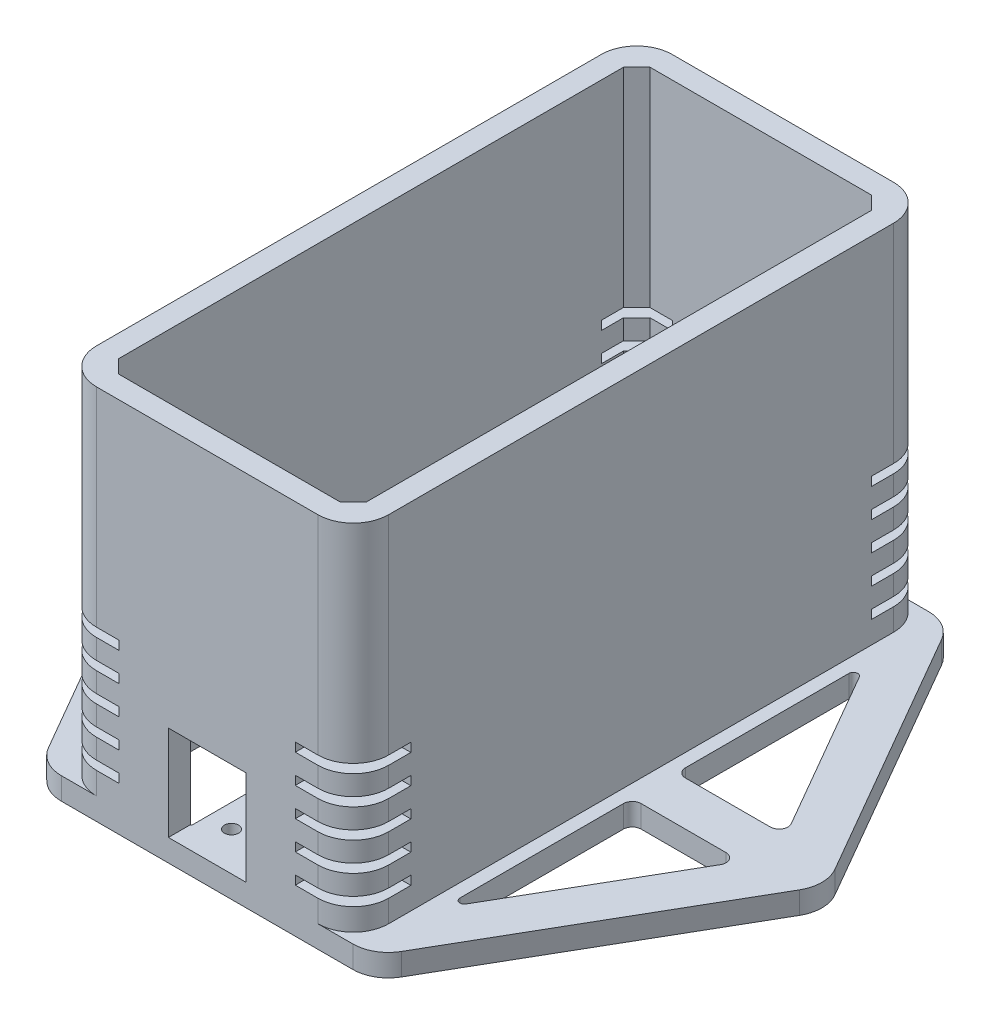
from build123d import *

# Parameters (mm, degrees)
BOSS_EXTRUDE1_DEPTH            = 5
FILLET1_R                      = 8
BOSS_EXTRUDE2_DEPTH            = 80
CUT_EXTRUDE1_DEPTH             = 85
CUT_EXTRUDE2_DEPTH             = 5
SKETCH9_W                      = 14
SKETCH9_H                      = 13
CUT_EXTRUDE3_DEPTH             = 2
LPATTERN1_COUNT                = 5
LPATTERN1_PITCH                = 6.5
MIRROR1_COPY_1_SKETCH_W        = 14
MIRROR1_COPY_1_SKETCH_H        = 13
MIRROR1_COPY_1_DEPTH           = 2
MIRROR1_COPY_2_SKETCH_W        = 14
MIRROR1_COPY_2_SKETCH_H        = 13
MIRROR1_COPY_2_DEPTH           = 2
MIRROR1_COPY_3_SKETCH_W        = 14
MIRROR1_COPY_3_SKETCH_H        = 13
MIRROR1_COPY_3_DEPTH           = 2
MIRROR1_COPY_4_SKETCH_W        = 14
MIRROR1_COPY_4_SKETCH_H        = 13
MIRROR1_COPY_4_DEPTH           = 2
SKETCH10_W                     = 17
SKETCH10_H                     = 5
BOSS_EXTRUDE3_DEPTH            = 15
SKETCH11_R                     = 1.6
CUT_EXTRUDE4_DEPTH             = 5
CUT_EXTRUDE5_REACH             = 170.223
SKETCH12_W                     = 17.5
SKETCH12_H                     = 21.4
CUT_EXTRUDE5_DIRECTION_2_REACH = 170.223
SKETCH14_W                     = 17
SKETCH14_H                     = 5
BOSS_EXTRUDE4_DEPTH            = 15
SKETCH16_R                     = 1.6
CUT_EXTRUDE6_DEPTH             = 5
MIRROR2_COPY_1_SKETCH_W        = 14
MIRROR2_COPY_1_SKETCH_H        = 13
MIRROR2_COPY_1_DEPTH           = 2
MIRROR2_COPY_2_SKETCH_W        = 14
MIRROR2_COPY_2_SKETCH_H        = 13
MIRROR2_COPY_2_DEPTH           = 2
MIRROR2_COPY_3_SKETCH_W        = 14
MIRROR2_COPY_3_SKETCH_H        = 13
MIRROR2_COPY_3_DEPTH           = 2
MIRROR2_COPY_4_SKETCH_W        = 14
MIRROR2_COPY_4_SKETCH_H        = 13
MIRROR2_COPY_4_DEPTH           = 2
MIRROR2_COPY_5_SKETCH_W        = 14
MIRROR2_COPY_5_SKETCH_H        = 13
MIRROR2_COPY_5_DEPTH           = 2
MIRROR2_COPY_6_SKETCH_W        = 14
MIRROR2_COPY_6_SKETCH_H        = 13
MIRROR2_COPY_6_DEPTH           = 2
MIRROR2_COPY_7_SKETCH_W        = 14
MIRROR2_COPY_7_SKETCH_H        = 13
MIRROR2_COPY_7_DEPTH           = 2
MIRROR2_COPY_8_SKETCH_W        = 14
MIRROR2_COPY_8_SKETCH_H        = 13
MIRROR2_COPY_8_DEPTH           = 2
MIRROR2_COPY_9_SKETCH_W        = 14
MIRROR2_COPY_9_SKETCH_H        = 13
MIRROR2_COPY_9_DEPTH           = 2


with BuildPart() as part:
    # Sketch1 → Boss-Extrude1 (new body)
    with BuildSketch(Plane(origin=(0, 0, 0), x_dir=(1, 0, 0), z_dir=(0, 1, 0))):
        Polygon((-75.055534995, 0), (-37.527767497, -65), (37.527767497, -65), (75.055534995, 0), (37.527767497, 65), (-37.527767497, 65), align=None)
    extrude(amount=BOSS_EXTRUDE1_DEPTH)

    # Fillet1
    fillet1_edges = [part.edges().sort_by_distance(p)[0] for p in [
        (-37.527767497, 2.5, -65),
        (37.527767497, 2.5, -65),
        (75.055534995, 2.5, 0),
        (37.527767497, 2.5, 65),
        (-37.527767497, 2.5, 65),
        (-75.055534995, 2.5, 0),
    ]]
    fillet(fillet1_edges, radius=FILLET1_R)

    # Sketch3 → Boss-Extrude2 (add)
    with BuildSketch(Plane(origin=(0, 5, 0), x_dir=(1, 0, 0), z_dir=(0, 1, 0))):
        with BuildLine():
            Line((-25, 65), (25, 65))
            ThreePointArc((25, 65), (30.656854249, 62.656854249), (33, 57))
            Line((33, 57), (33, -57))
            ThreePointArc((33, -57), (30.656854249, -62.656854249), (25, -65))
            Line((25, -65), (-25, -65))
            ThreePointArc((-25, -65), (-30.656854249, -62.656854249), (-33, -57))
            Line((-33, -57), (-33, 57))
            ThreePointArc((-33, 57), (-30.656854249, 62.656854249), (-25, 65))
        make_face()
    extrude(amount=BOSS_EXTRUDE2_DEPTH)

    # Sketch4 → Cut-Extrude1 (cut)
    with BuildSketch(Plane(origin=(0, 85, 0), x_dir=(1, 0, 0), z_dir=(0, 1, 0))):
        Polygon((-28, 57), (-25, 60), (25, 60), (28, 57), (28, -57), (25, -60), (-25, -60), (-28, -57), align=None)
    extrude(amount=-CUT_EXTRUDE1_DEPTH, mode=Mode.SUBTRACT)

    # Sketch8 → Cut-Extrude2 (cut)
    with BuildSketch(Plane(origin=(0, 0, 0), x_dir=(1, 0, 0), z_dir=(0, 1, 0))):
        with BuildLine():
            Line((-37.866025404, 44.41412012), (-58.889727457, 8))
            ThreePointArc((-58.889727457, 8), (-58.889727457, 6), (-57.15767665, 5))
            Line((-57.15767665, 5), (-38, 5))
            ThreePointArc((-38, 5), (-36.585786438, 5.585786438), (-36, 7))
            Line((-36, 7), (-36, 43.91412012))
            ThreePointArc((-36, 43.91412012), (-36.741180955, 44.880045946), (-37.866025404, 44.41412012))
        make_face()
        with BuildLine():
            Line((-36, -7), (-36, -43.91412012))
            ThreePointArc((-36, -43.91412012), (-36.741180955, -44.880045946), (-37.866025404, -44.41412012))
            Line((-37.866025404, -44.41412012), (-58.889727457, -8))
            ThreePointArc((-58.889727457, -8), (-58.889727457, -6), (-57.15767665, -5))
            Line((-57.15767665, -5), (-38, -5))
            ThreePointArc((-38, -5), (-36.585786438, -5.585786438), (-36, -7))
        make_face()
        with BuildLine():
            Line((37.866025404, -44.41412012), (58.889727457, -8))
            ThreePointArc((58.889727457, -8), (58.889727457, -6), (57.15767665, -5))
            Line((57.15767665, -5), (38, -5))
            ThreePointArc((38, -5), (36.585786438, -5.585786438), (36, -7))
            Line((36, -7), (36, -43.91412012))
            ThreePointArc((36, -43.91412012), (36.741180955, -44.880045946), (37.866025404, -44.41412012))
        make_face()
        with BuildLine():
            Line((36, 7), (36, 43.91412012))
            ThreePointArc((36, 43.91412012), (36.741180955, 44.880045946), (37.866025404, 44.41412012))
            Line((37.866025404, 44.41412012), (58.889727457, 8))
            ThreePointArc((58.889727457, 8), (58.889727457, 6), (57.15767665, 5))
            Line((57.15767665, 5), (38, 5))
            ThreePointArc((38, 5), (36.585786438, 5.585786438), (36, 7))
        make_face()
    extrude(amount=CUT_EXTRUDE2_DEPTH, mode=Mode.SUBTRACT)

    # Sketch9 → Cut-Extrude3 (cut)
    with BuildSketch(Plane(origin=(0, 10, 0), x_dir=(1, 0, 0), z_dir=(0, 1, 0))):
        with Locations((-26.908965344, -58.5)):
            Rectangle(SKETCH9_W, SKETCH9_H)
    cut_extrude3 = extrude(amount=CUT_EXTRUDE3_DEPTH, mode=Mode.SUBTRACT)

    # LPattern1: Cut-Extrude3 ×5
    with Locations(*[(0, i * LPATTERN1_PITCH, 0) for i in range(1, LPATTERN1_COUNT)]):
        add(cut_extrude3, mode=Mode.SUBTRACT)

    # Mirror1: Cut-Extrude3 across plane
    add(cut_extrude3.mirror(Plane(origin=(0, 0, 0), x_dir=(0, 0, 1), z_dir=(1, 0, 0))), mode=Mode.SUBTRACT)

    # Mirror1 copy 1 sketch → Mirror1 copy 1 (cut)
    with BuildSketch(Plane(origin=(0, 16.5, 0), x_dir=(-1, 0, 0), z_dir=(0, 1, 0))):
        with Locations((-26.908965344, 58.5)):
            Rectangle(MIRROR1_COPY_1_SKETCH_W, MIRROR1_COPY_1_SKETCH_H)
    extrude(amount=MIRROR1_COPY_1_DEPTH, mode=Mode.SUBTRACT)

    # Mirror1 copy 2 sketch → Mirror1 copy 2 (cut)
    with BuildSketch(Plane(origin=(0, 23, 0), x_dir=(-1, 0, 0), z_dir=(0, 1, 0))):
        with Locations((-26.908965344, 58.5)):
            Rectangle(MIRROR1_COPY_2_SKETCH_W, MIRROR1_COPY_2_SKETCH_H)
    extrude(amount=MIRROR1_COPY_2_DEPTH, mode=Mode.SUBTRACT)

    # Mirror1 copy 3 sketch → Mirror1 copy 3 (cut)
    with BuildSketch(Plane(origin=(0, 29.5, 0), x_dir=(-1, 0, 0), z_dir=(0, 1, 0))):
        with Locations((-26.908965344, 58.5)):
            Rectangle(MIRROR1_COPY_3_SKETCH_W, MIRROR1_COPY_3_SKETCH_H)
    extrude(amount=MIRROR1_COPY_3_DEPTH, mode=Mode.SUBTRACT)

    # Mirror1 copy 4 sketch → Mirror1 copy 4 (cut)
    with BuildSketch(Plane(origin=(0, 36, 0), x_dir=(-1, 0, 0), z_dir=(0, 1, 0))):
        with Locations((-26.908965344, 58.5)):
            Rectangle(MIRROR1_COPY_4_SKETCH_W, MIRROR1_COPY_4_SKETCH_H)
    extrude(amount=MIRROR1_COPY_4_DEPTH, mode=Mode.SUBTRACT)

    # Sketch10 → Boss-Extrude3 (add)
    with BuildSketch(Plane.XY.offset(-60)):
        with Locations((0, 2.5)):
            Rectangle(SKETCH10_W, SKETCH10_H)
    extrude(amount=BOSS_EXTRUDE3_DEPTH)

    # Sketch11 → Cut-Extrude4 (cut)
    with BuildSketch(Plane.XZ):
        with Locations(Location((3.25, -56.25, 0), (0, 0, 270))):
            Circle(SKETCH11_R)
        with Locations(Location((-3.25, -56.25, 0), (0, 0, 90))):
            Circle(SKETCH11_R)
        with Locations(Location((-3.25, -48.75, 0), (0, 0, 270))):
            Circle(SKETCH11_R)
        with Locations(Location((3.25, -48.75, 0), (0, 0, 90))):
            Circle(SKETCH11_R)
    extrude(amount=-CUT_EXTRUDE4_DEPTH, mode=Mode.SUBTRACT)

    # Cut-Extrude5: up to this face of the body (flat: up to its plane)
    cut_extrude5_end = Plane(part.part.faces().sort_by_distance((0, 41.769226006, -65))[0])
    # Sketch12 → Cut-Extrude5 (cut, up to the picked face)
    with BuildSketch(Plane.XY.offset(-60), mode=Mode.PRIVATE) as cut_extrude5_sk1:
        with Locations((0, 15.7)):
            Rectangle(SKETCH12_W, SKETCH12_H)
    cut_extrude5_tool1 = split(extrude(cut_extrude5_sk1.sketch, amount=-CUT_EXTRUDE5_REACH, mode=Mode.PRIVATE), bisect_by=cut_extrude5_end, keep=Keep.BOTH, mode=Mode.PRIVATE)
    add(cut_extrude5_tool1.solids().sort_by(Axis((0, 15.7, -60), (0, 0, -1)))[0], mode=Mode.SUBTRACT)

    # Cut-Extrude5 direction 2: up to this face of the body (flat: up to its plane)
    cut_extrude5_direction_2_end = Plane(part.part.faces().sort_by_distance((0, 42.197226903, 65))[0])
    # Sketch12 → Cut-Extrude5 direction 2 (cut, up to the picked face)
    with BuildSketch(Plane.XY.offset(-60), mode=Mode.PRIVATE) as cut_extrude5_direction_2_sk1:
        with Locations((0, 15.7)):
            Rectangle(SKETCH12_W, SKETCH12_H)
    cut_extrude5_direction_2_tool1 = split(extrude(cut_extrude5_direction_2_sk1.sketch, amount=CUT_EXTRUDE5_DIRECTION_2_REACH, mode=Mode.PRIVATE), bisect_by=cut_extrude5_direction_2_end, keep=Keep.BOTH, mode=Mode.PRIVATE)
    add(cut_extrude5_direction_2_tool1.solids().sort_by(Axis((0, 15.7, -60), (0, 0, 1)))[0], mode=Mode.SUBTRACT)

    # Sketch14 → Boss-Extrude4 (add)
    with BuildSketch(Plane(origin=(0, 0, 60), x_dir=(-1, 0, 0), z_dir=(0, 0, -1))):
        with Locations((0, 2.5)):
            Rectangle(SKETCH14_W, SKETCH14_H)
    extrude(amount=BOSS_EXTRUDE4_DEPTH)

    # Sketch16 → Cut-Extrude6 (cut)
    with BuildSketch(Plane.XZ):
        with Locations(Location((3.25, 48.75, 0), (0, 0, 270))):
            Circle(SKETCH16_R)
        with Locations(Location((-3.25, 48.75, 0), (0, 0, 90))):
            Circle(SKETCH16_R)
        with Locations(Location((-3.25, 56.25, 0), (0, 0, 270))):
            Circle(SKETCH16_R)
        with Locations(Location((3.25, 56.25, 0), (0, 0, 90))):
            Circle(SKETCH16_R)
    extrude(amount=-CUT_EXTRUDE6_DEPTH, mode=Mode.SUBTRACT)

    # Mirror2: Cut-Extrude3 across plane
    add(cut_extrude3.mirror(Plane.XY), mode=Mode.SUBTRACT)

    # Mirror2 copy 1 sketch → Mirror2 copy 1 (cut)
    with BuildSketch(Plane(origin=(0, 16.5, 0), x_dir=(1, 0, 0), z_dir=(0, 1, 0))):
        with Locations((-26.908965344, 58.5)):
            Rectangle(MIRROR2_COPY_1_SKETCH_W, MIRROR2_COPY_1_SKETCH_H)
    extrude(amount=MIRROR2_COPY_1_DEPTH, mode=Mode.SUBTRACT)

    # Mirror2 copy 2 sketch → Mirror2 copy 2 (cut)
    with BuildSketch(Plane(origin=(0, 23, 0), x_dir=(1, 0, 0), z_dir=(0, 1, 0))):
        with Locations((-26.908965344, 58.5)):
            Rectangle(MIRROR2_COPY_2_SKETCH_W, MIRROR2_COPY_2_SKETCH_H)
    extrude(amount=MIRROR2_COPY_2_DEPTH, mode=Mode.SUBTRACT)

    # Mirror2 copy 3 sketch → Mirror2 copy 3 (cut)
    with BuildSketch(Plane(origin=(0, 29.5, 0), x_dir=(1, 0, 0), z_dir=(0, 1, 0))):
        with Locations((-26.908965344, 58.5)):
            Rectangle(MIRROR2_COPY_3_SKETCH_W, MIRROR2_COPY_3_SKETCH_H)
    extrude(amount=MIRROR2_COPY_3_DEPTH, mode=Mode.SUBTRACT)

    # Mirror2 copy 4 sketch → Mirror2 copy 4 (cut)
    with BuildSketch(Plane(origin=(0, 36, 0), x_dir=(1, 0, 0), z_dir=(0, 1, 0))):
        with Locations((-26.908965344, 58.5)):
            Rectangle(MIRROR2_COPY_4_SKETCH_W, MIRROR2_COPY_4_SKETCH_H)
    extrude(amount=MIRROR2_COPY_4_DEPTH, mode=Mode.SUBTRACT)

    # Mirror2 copy 5 sketch → Mirror2 copy 5 (cut)
    with BuildSketch(Plane(origin=(0, 10, 0), x_dir=(-1, 0, 0), z_dir=(0, 1, 0))):
        with Locations((-26.908965344, -58.5)):
            Rectangle(MIRROR2_COPY_5_SKETCH_W, MIRROR2_COPY_5_SKETCH_H)
    extrude(amount=MIRROR2_COPY_5_DEPTH, mode=Mode.SUBTRACT)

    # Mirror2 copy 6 sketch → Mirror2 copy 6 (cut)
    with BuildSketch(Plane(origin=(0, 16.5, 0), x_dir=(-1, 0, 0), z_dir=(0, 1, 0))):
        with Locations((-26.908965344, -58.5)):
            Rectangle(MIRROR2_COPY_6_SKETCH_W, MIRROR2_COPY_6_SKETCH_H)
    extrude(amount=MIRROR2_COPY_6_DEPTH, mode=Mode.SUBTRACT)

    # Mirror2 copy 7 sketch → Mirror2 copy 7 (cut)
    with BuildSketch(Plane(origin=(0, 23, 0), x_dir=(-1, 0, 0), z_dir=(0, 1, 0))):
        with Locations((-26.908965344, -58.5)):
            Rectangle(MIRROR2_COPY_7_SKETCH_W, MIRROR2_COPY_7_SKETCH_H)
    extrude(amount=MIRROR2_COPY_7_DEPTH, mode=Mode.SUBTRACT)

    # Mirror2 copy 8 sketch → Mirror2 copy 8 (cut)
    with BuildSketch(Plane(origin=(0, 29.5, 0), x_dir=(-1, 0, 0), z_dir=(0, 1, 0))):
        with Locations((-26.908965344, -58.5)):
            Rectangle(MIRROR2_COPY_8_SKETCH_W, MIRROR2_COPY_8_SKETCH_H)
    extrude(amount=MIRROR2_COPY_8_DEPTH, mode=Mode.SUBTRACT)

    # Mirror2 copy 9 sketch → Mirror2 copy 9 (cut)
    with BuildSketch(Plane(origin=(0, 36, 0), x_dir=(-1, 0, 0), z_dir=(0, 1, 0))):
        with Locations((-26.908965344, -58.5)):
            Rectangle(MIRROR2_COPY_9_SKETCH_W, MIRROR2_COPY_9_SKETCH_H)
    extrude(amount=MIRROR2_COPY_9_DEPTH, mode=Mode.SUBTRACT)


solid = part.part
